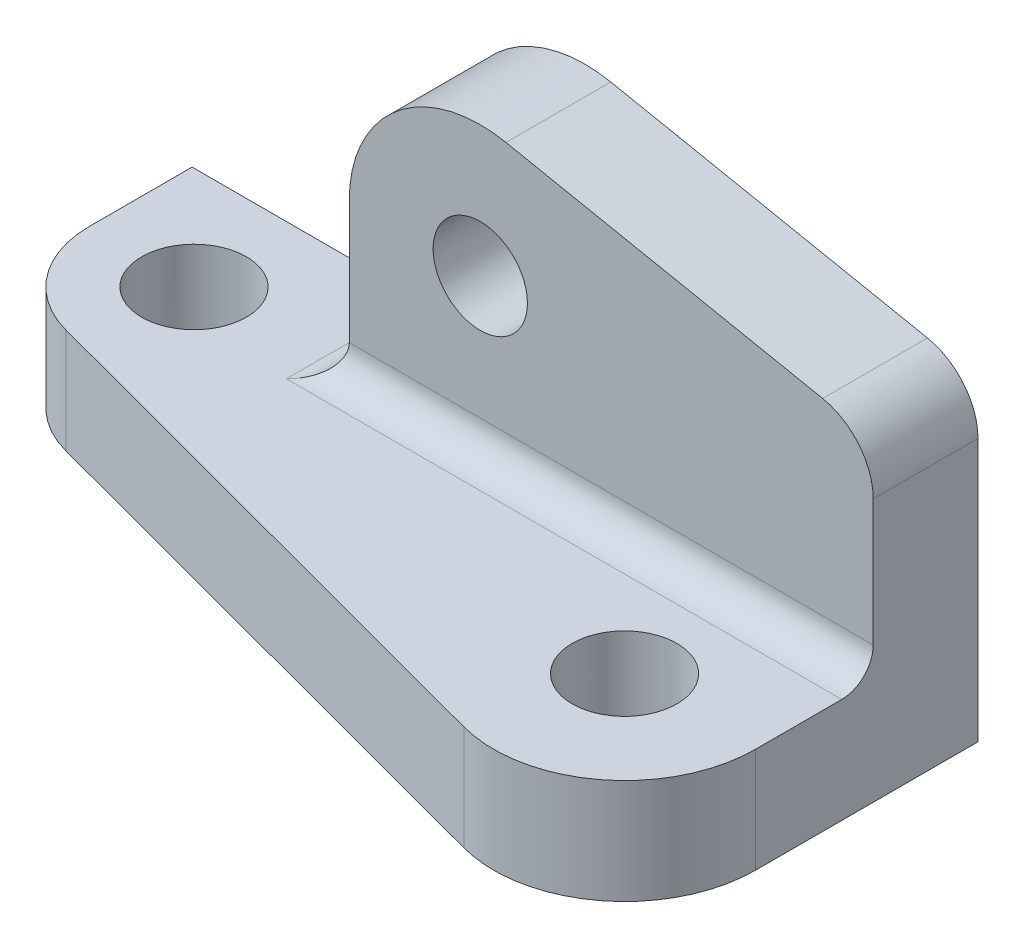
from build123d import *

# Parameters (mm, degrees)
BOSS_EXTRUDE1_DEPTH     = 20
BOSS_EXTRUDE2_DEPTH     = 20
FILLET1_R               = 12
FILLET2_R               = 20
FILLET3_R               = 25
FILLET4_R               = 6
F_1_0_MM_DOWEL_HOLES1_D = 20
F_1_0_MM_DOWEL_HOLES2_D = 18


with BuildPart() as part:
    # Sketch1 → Boss-Extrude1 (new body)
    with BuildSketch(Plane(origin=(0, 0, 0), x_dir=(1, 0, 0), z_dir=(0, 1, 0))):
        Polygon((0, 0), (0, -75), (-150, -35), (-150, 0), align=None)
    extrude(amount=BOSS_EXTRUDE1_DEPTH)

    # Sketch2 → Boss-Extrude2 (add)
    with BuildSketch(Plane(origin=(0, 0, 0), x_dir=(-1, 0, 0), z_dir=(0, 0, -1))):
        Polygon((0, 0), (0, 60), (100, 80), (100, 0), align=None)
    extrude(amount=-BOSS_EXTRUDE2_DEPTH)

    # Fillet1
    fillet1_edges = [part.edges().sort_by_distance(p)[0] for p in [
        (0, 60, 10),
    ]]
    fillet(fillet1_edges, radius=FILLET1_R)

    # Fillet2
    fillet2_edges = [part.edges().sort_by_distance(p)[0] for p in [
        (-150, 10, 35),
    ]]
    fillet(fillet2_edges, radius=FILLET2_R)

    # Fillet3
    fillet3_edges = [part.edges().sort_by_distance(p)[0] for p in [
        (-100, 80, 10),
        (0, 10, 75),
    ]]
    fillet(fillet3_edges, radius=FILLET3_R)

    # Fillet4
    fillet4_edges = [part.edges().sort_by_distance(p)[0] for p in [
        (-100, 20, 10),
        (-50, 20, 20),
    ]]
    fillet(fillet4_edges, radius=FILLET4_R)

    # Ø1.0 mm Dowel Holes1 (through all)
    with Locations(Plane(origin=(0, 20, 0), x_dir=(1, 0, 0), z_dir=(0, 1, 0))):
        with Locations((-130, -19.634433738), (-25, -42.45970884)):
            Hole(F_1_0_MM_DOWEL_HOLES1_D / 2)

    # Ø1.0 mm Dowel Holes2 (through all)
    with Locations(Plane.XY.offset(20)):
        with Locations((-75, 49.504902432)):
            Hole(F_1_0_MM_DOWEL_HOLES2_D / 2)


solid = part.part
